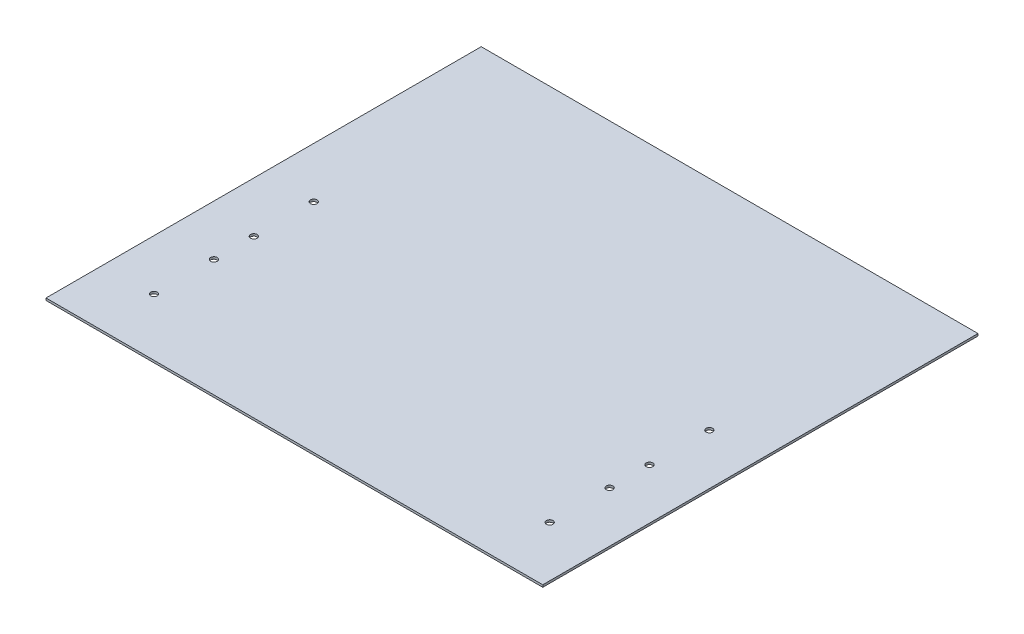
from build123d import *

# Parameters (mm, degrees)
SKETCH1_W           = 226
SKETCH1_H           = 198
BOSS_EXTRUDE1_DEPTH = 1
SKETCH2_R           = 1.5
CUT_EXTRUDE1_DEPTH  = 1


with BuildPart() as part:
    # Sketch1 → Boss-Extrude1 (new body)
    with BuildSketch(Plane(origin=(0, 0, 0), x_dir=(1, 0, 0), z_dir=(0, 1, 0))):
        with Locations((113, 99)):
            Rectangle(SKETCH1_W, SKETCH1_H)
    extrude(amount=BOSS_EXTRUDE1_DEPTH)

    # Sketch2 → Cut-Extrude1 (cut)
    with BuildSketch(Plane(origin=(0, 1, 0), x_dir=(1, 0, 0), z_dir=(0, 1, 0))):
        with Locations(Location((203, 26.16, 0), (0, 0, 90))):
            Circle(SKETCH2_R)
        with Locations(Location((203, 53.4, 0), (0, 0, 90))):
            Circle(SKETCH2_R)
        with Locations(Location((203, 71.557761971, 0), (0, 0, 90))):
            Circle(SKETCH2_R)
        with Locations(Location((203, 98.797761995, 0), (0, 0, 90))):
            Circle(SKETCH2_R)
        with Locations(Location((23, 26.16, 0), (0, 0, 270))):
            Circle(SKETCH2_R)
        with Locations(Location((23, 53.4, 0), (0, 0, 270))):
            Circle(SKETCH2_R)
        with Locations(Location((23, 71.557761971, 0), (0, 0, 270))):
            Circle(SKETCH2_R)
        with Locations(Location((23, 98.797761995, 0), (0, 0, 270))):
            Circle(SKETCH2_R)
    extrude(amount=-CUT_EXTRUDE1_DEPTH, mode=Mode.SUBTRACT)


solid = part.part
